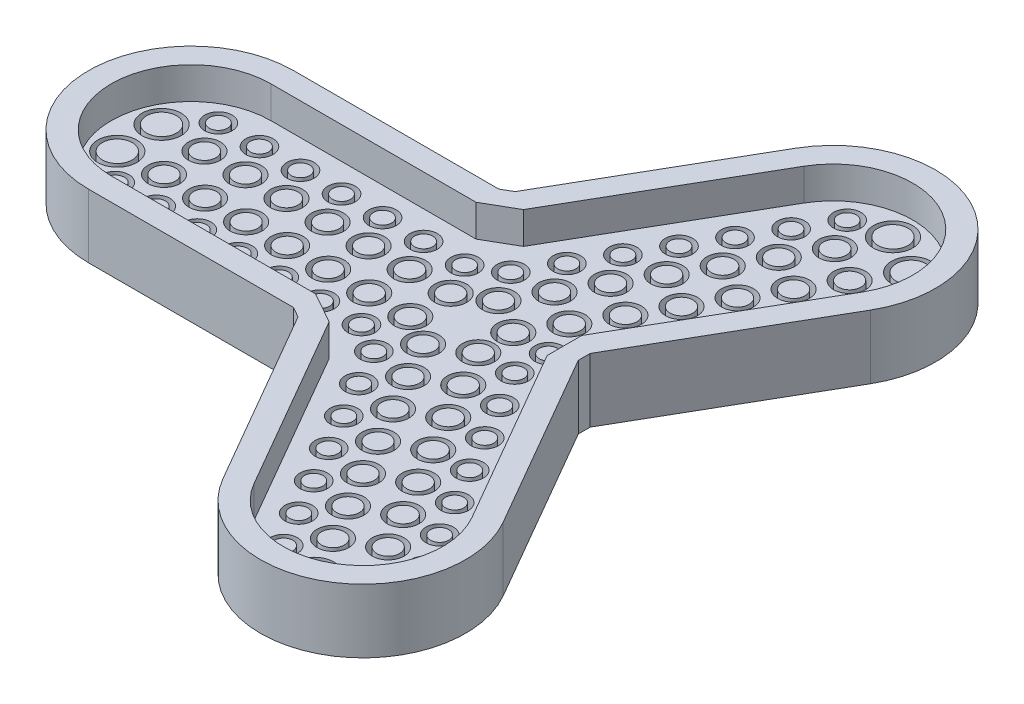
from build123d import *

# Parameters (mm, degrees)
BOSS_EXTRUDE1_DEPTH = 14
BOSS_EXTRUDE2_DEPTH = 7
SKETCH2_R           = 3.5
SKETCH2_R_2         = 2.5
SKETCH2_R_3         = 3
SKETCH2_R_4         = 2
SKETCH2_R_5         = 4.287290874
SKETCH2_R_6         = 3.287290874
CUT_EXTRUDE1_DEPTH  = 4


with BuildPart() as part:
    # Sketch1 → Boss-Extrude1 (new body)
    with BuildSketch(Plane(origin=(0, 0, 0), x_dir=(1, 0, 0), z_dir=(0, 1, 0))):
        with BuildLine():
            Line((-22.5, -22.5), (22.5, -22.5))
            Line((22.5, -22.5), (24.764428415, -23.807368355))
            Line((24.764428415, -23.807368355), (47.264428415, -62.778511525))
            ThreePointArc((47.264428415, -62.778511525), (78, -71.01408311), (86.235571585, -40.278511525))
            Line((86.235571585, -40.278511525), (63.735571585, -1.307368355))
            Line((63.735571585, -1.307368355), (63.735571585, 1.307368355))
            Line((63.735571585, 1.307368355), (86.235571585, 40.278511525))
            ThreePointArc((86.235571585, 40.278511525), (78, 71.01408311), (47.264428415, 62.778511525))
            Line((47.264428415, 62.778511525), (24.764428415, 23.807368355))
            Line((24.764428415, 23.807368355), (22.5, 22.5))
            Line((22.5, 22.5), (-22.5, 22.5))
            ThreePointArc((-22.5, 22.5), (-45, 0), (-22.5, -22.5))
        make_face()
        with BuildLine():
            ThreePointArc((-22.5, -17.5), (-40, 0), (-22.5, 17.5))
            Line((-22.5, 17.5), (22.5, 17.5))
            Line((22.5, 17.5), (29.094555434, 21.307368355))
            Line((29.094555434, 21.307368355), (51.594555434, 60.278511525))
            ThreePointArc((51.594555434, 60.278511525), (75.5, 66.683956091), (81.905444566, 42.778511525))
            Line((81.905444566, 42.778511525), (59.405444566, 3.807368355))
            Line((59.405444566, 3.807368355), (59.405444566, -3.807368355))
            Line((59.405444566, -3.807368355), (81.905444566, -42.778511525))
            ThreePointArc((81.905444566, -42.778511525), (75.5, -66.683956091), (51.594555434, -60.278511525))
            Line((51.594555434, -60.278511525), (29.094555434, -21.307368355))
            Line((29.094555434, -21.307368355), (22.299592432, -17.5))
            Line((22.299592432, -17.5), (-22.5, -17.5))
        make_face(mode=Mode.SUBTRACT)
    extrude(amount=BOSS_EXTRUDE1_DEPTH)

    # Sketch1<2> → Boss-Extrude2 (add)
    with BuildSketch(Plane(origin=(0, 0, 0), x_dir=(1, 0, 0), z_dir=(0, 1, 0))):
        with BuildLine():
            Line((22.299592432, 17.5), (-22.5, 17.5))
            ThreePointArc((-22.5, 17.5), (-40, 0), (-22.5, -17.5))
            Line((-22.5, -17.5), (22.299592432, -17.5))
            Line((22.299592432, -17.5), (29.094555434, -21.307368355))
            Line((29.094555434, -21.307368355), (29.194759218, -21.4809264))
            Line((29.194759218, -21.4809264), (51.594555434, -60.278511525))
            ThreePointArc((51.594555434, -60.278511525), (75.5, -66.683956091), (81.905444566, -42.778511525))
            Line((81.905444566, -42.778511525), (59.50564835, -3.9809264))
            Line((59.50564835, -3.9809264), (59.405444566, -3.807368355))
            Line((59.405444566, -3.807368355), (59.405444566, 3.807368355))
            Line((59.405444566, 3.807368355), (59.50564835, 3.9809264))
            Line((59.50564835, 3.9809264), (81.905444566, 42.778511525))
            ThreePointArc((81.905444566, 42.778511525), (75.5, 66.683956091), (51.594555434, 60.278511525))
            Line((51.594555434, 60.278511525), (29.194759218, 21.4809264))
            Line((29.194759218, 21.4809264), (29.094555434, 21.307368355))
            Line((29.094555434, 21.307368355), (22.5, 17.5))
            Line((22.5, 17.5), (22.299592432, 17.5))
        make_face()
    extrude(amount=BOSS_EXTRUDE2_DEPTH)

    # Sketch2 → Cut-Extrude1 (cut)
    # profile 1 of 90: a face of its own
    with BuildSketch(Plane(origin=(0, 7, 0), x_dir=(1, 0, 0), z_dir=(0, 1, 0))):
        with Locations((30.011797316, -4.431729837)):
            Circle(SKETCH2_R)
        with Locations((30.011797316, -4.431729837)):
            Circle(SKETCH2_R_2, mode=Mode.SUBTRACT)
    # profile 2 of 90: a face of its own
    with BuildSketch(Plane(origin=(0, 7, 0), x_dir=(1, 0, 0), z_dir=(0, 1, 0))):
        with Locations((21.011797316, -4.431729837)):
            Circle(SKETCH2_R)
        with Locations((21.011797316, -4.431729837)):
            Circle(SKETCH2_R_2, mode=Mode.SUBTRACT)
    # profile 3 of 90: a face of its own
    with BuildSketch(Plane(origin=(0, 7, 0), x_dir=(1, 0, 0), z_dir=(0, 1, 0))):
        with Locations((12.011797316, -4.431729837)):
            Circle(SKETCH2_R)
        with Locations((12.011797316, -4.431729837)):
            Circle(SKETCH2_R_2, mode=Mode.SUBTRACT)
    # profile 4 of 90: a face of its own
    with BuildSketch(Plane(origin=(0, 7, 0), x_dir=(1, 0, 0), z_dir=(0, 1, 0))):
        with Locations((3.011797316, -4.431729837)):
            Circle(SKETCH2_R)
        with Locations((3.011797316, -4.431729837)):
            Circle(SKETCH2_R_2, mode=Mode.SUBTRACT)
    # profile 5 of 90: a face of its own
    with BuildSketch(Plane(origin=(0, 7, 0), x_dir=(1, 0, 0), z_dir=(0, 1, 0))):
        with Locations((-5.988202684, -4.431729837)):
            Circle(SKETCH2_R)
        with Locations((-5.988202684, -4.431729837)):
            Circle(SKETCH2_R_2, mode=Mode.SUBTRACT)
    # profile 6 of 90: a face of its own
    with BuildSketch(Plane(origin=(0, 7, 0), x_dir=(1, 0, 0), z_dir=(0, 1, 0))):
        with Locations((-14.988202684, -4.431729837)):
            Circle(SKETCH2_R)
        with Locations((-14.988202684, -4.431729837)):
            Circle(SKETCH2_R_2, mode=Mode.SUBTRACT)
    # profile 7 of 90: a face of its own
    with BuildSketch(Plane(origin=(0, 7, 0), x_dir=(1, 0, 0), z_dir=(0, 1, 0))):
        with Locations((-27.809609086, -11.315014847)):
            Circle(SKETCH2_R_3)
        with Locations((-27.809609086, -11.315014847)):
            Circle(SKETCH2_R_4, mode=Mode.SUBTRACT)
    # profile 8 of 90: a face of its own
    with BuildSketch(Plane(origin=(0, 7, 0), x_dir=(1, 0, 0), z_dir=(0, 1, 0))):
        with Locations((-18.809609086, -11.315014847)):
            Circle(SKETCH2_R_3)
        with Locations((-18.809609086, -11.315014847)):
            Circle(SKETCH2_R_4, mode=Mode.SUBTRACT)
    # profile 9 of 90: a face of its own
    with BuildSketch(Plane(origin=(0, 7, 0), x_dir=(1, 0, 0), z_dir=(0, 1, 0))):
        with Locations((-9.809609086, -11.315014847)):
            Circle(SKETCH2_R_3)
        with Locations((-9.809609086, -11.315014847)):
            Circle(SKETCH2_R_4, mode=Mode.SUBTRACT)
    # profile 10 of 90: a face of its own
    with BuildSketch(Plane(origin=(0, 7, 0), x_dir=(1, 0, 0), z_dir=(0, 1, 0))):
        with Locations((-0.809609086, -11.315014847)):
            Circle(SKETCH2_R_3)
        with Locations((-0.809609086, -11.315014847)):
            Circle(SKETCH2_R_4, mode=Mode.SUBTRACT)
    # profile 11 of 90: a face of its own
    with BuildSketch(Plane(origin=(0, 7, 0), x_dir=(1, 0, 0), z_dir=(0, 1, 0))):
        with Locations((8.190390914, -11.315014847)):
            Circle(SKETCH2_R_3)
        with Locations((8.190390914, -11.315014847)):
            Circle(SKETCH2_R_4, mode=Mode.SUBTRACT)
    # profile 12 of 90: a face of its own
    with BuildSketch(Plane(origin=(0, 7, 0), x_dir=(1, 0, 0), z_dir=(0, 1, 0))):
        with Locations((17.190390914, -11.315014847)):
            Circle(SKETCH2_R_3)
        with Locations((17.190390914, -11.315014847)):
            Circle(SKETCH2_R_4, mode=Mode.SUBTRACT)
    # profile 13 of 90: a face of its own
    with BuildSketch(Plane(origin=(0, 7, 0), x_dir=(1, 0, 0), z_dir=(0, 1, 0))):
        with Locations((26.190390914, -11.315014847)):
            Circle(SKETCH2_R_3)
        with Locations((26.190390914, -11.315014847)):
            Circle(SKETCH2_R_4, mode=Mode.SUBTRACT)
    # profile 14 of 90: a face of its own
    with BuildSketch(Plane(origin=(0, 7, 0), x_dir=(1, 0, 0), z_dir=(0, 1, 0))):
        with Locations((-23.988202684, -4.431729837)):
            Circle(SKETCH2_R)
        with Locations((-23.988202684, -4.431729837)):
            Circle(SKETCH2_R_2, mode=Mode.SUBTRACT)
    # profile 15 of 90: a face of its own
    with BuildSketch(Plane(origin=(0, 7, 0), x_dir=(1, 0, 0), z_dir=(0, 1, 0))):
        with Locations((-23.988202684, 4.431729837)):
            Circle(SKETCH2_R)
        with Locations((-23.988202684, 4.431729837)):
            Circle(SKETCH2_R_2, mode=Mode.SUBTRACT)
    # profile 16 of 90: a face of its own
    with BuildSketch(Plane(origin=(0, 7, 0), x_dir=(1, 0, 0), z_dir=(0, 1, 0))):
        with Locations((-14.988202684, 4.431729837)):
            Circle(SKETCH2_R)
        with Locations((-14.988202684, 4.431729837)):
            Circle(SKETCH2_R_2, mode=Mode.SUBTRACT)
    # profile 17 of 90: a face of its own
    with BuildSketch(Plane(origin=(0, 7, 0), x_dir=(1, 0, 0), z_dir=(0, 1, 0))):
        with Locations((-5.988202684, 4.431729837)):
            Circle(SKETCH2_R)
        with Locations((-5.988202684, 4.431729837)):
            Circle(SKETCH2_R_2, mode=Mode.SUBTRACT)
    # profile 18 of 90: a face of its own
    with BuildSketch(Plane(origin=(0, 7, 0), x_dir=(1, 0, 0), z_dir=(0, 1, 0))):
        with Locations((3.011797316, 4.431729837)):
            Circle(SKETCH2_R)
        with Locations((3.011797316, 4.431729837)):
            Circle(SKETCH2_R_2, mode=Mode.SUBTRACT)
    # profile 19 of 90: a face of its own
    with BuildSketch(Plane(origin=(0, 7, 0), x_dir=(1, 0, 0), z_dir=(0, 1, 0))):
        with Locations((12.011797316, 4.431729837)):
            Circle(SKETCH2_R)
        with Locations((12.011797316, 4.431729837)):
            Circle(SKETCH2_R_2, mode=Mode.SUBTRACT)
    # profile 20 of 90: a face of its own
    with BuildSketch(Plane(origin=(0, 7, 0), x_dir=(1, 0, 0), z_dir=(0, 1, 0))):
        with Locations((21.011797316, 4.431729837)):
            Circle(SKETCH2_R)
        with Locations((21.011797316, 4.431729837)):
            Circle(SKETCH2_R_2, mode=Mode.SUBTRACT)
    # profile 21 of 90: a face of its own
    with BuildSketch(Plane(origin=(0, 7, 0), x_dir=(1, 0, 0), z_dir=(0, 1, 0))):
        with Locations((30.011797316, 4.431729837)):
            Circle(SKETCH2_R)
        with Locations((30.011797316, 4.431729837)):
            Circle(SKETCH2_R_2, mode=Mode.SUBTRACT)
    # profile 22 of 90: a face of its own
    with BuildSketch(Plane(origin=(0, 7, 0), x_dir=(1, 0, 0), z_dir=(0, 1, 0))):
        with Locations((26.190390914, 11.315014847)):
            Circle(SKETCH2_R_3)
        with Locations((26.190390914, 11.315014847)):
            Circle(SKETCH2_R_4, mode=Mode.SUBTRACT)
    # profile 23 of 90: a face of its own
    with BuildSketch(Plane(origin=(0, 7, 0), x_dir=(1, 0, 0), z_dir=(0, 1, 0))):
        with Locations((17.190390914, 11.315014847)):
            Circle(SKETCH2_R_3)
        with Locations((17.190390914, 11.315014847)):
            Circle(SKETCH2_R_4, mode=Mode.SUBTRACT)
    # profile 24 of 90: a face of its own
    with BuildSketch(Plane(origin=(0, 7, 0), x_dir=(1, 0, 0), z_dir=(0, 1, 0))):
        with Locations((8.190390914, 11.315014847)):
            Circle(SKETCH2_R_3)
        with Locations((8.190390914, 11.315014847)):
            Circle(SKETCH2_R_4, mode=Mode.SUBTRACT)
    # profile 25 of 90: a face of its own
    with BuildSketch(Plane(origin=(0, 7, 0), x_dir=(1, 0, 0), z_dir=(0, 1, 0))):
        with Locations((-0.809609086, 11.315014847)):
            Circle(SKETCH2_R_3)
        with Locations((-0.809609086, 11.315014847)):
            Circle(SKETCH2_R_4, mode=Mode.SUBTRACT)
    # profile 26 of 90: a face of its own
    with BuildSketch(Plane(origin=(0, 7, 0), x_dir=(1, 0, 0), z_dir=(0, 1, 0))):
        with Locations((-9.809609086, 11.315014847)):
            Circle(SKETCH2_R_3)
        with Locations((-9.809609086, 11.315014847)):
            Circle(SKETCH2_R_4, mode=Mode.SUBTRACT)
    # profile 27 of 90: a face of its own
    with BuildSketch(Plane(origin=(0, 7, 0), x_dir=(1, 0, 0), z_dir=(0, 1, 0))):
        with Locations((-18.809609086, 11.315014847)):
            Circle(SKETCH2_R_3)
        with Locations((-18.809609086, 11.315014847)):
            Circle(SKETCH2_R_4, mode=Mode.SUBTRACT)
    # profile 28 of 90: a face of its own
    with BuildSketch(Plane(origin=(0, 7, 0), x_dir=(1, 0, 0), z_dir=(0, 1, 0))):
        with Locations((-27.809609086, 11.315014847)):
            Circle(SKETCH2_R_3)
        with Locations((-27.809609086, 11.315014847)):
            Circle(SKETCH2_R_4, mode=Mode.SUBTRACT)
    # profile 29 of 90: a face of its own
    with BuildSketch(Plane(origin=(0, 7, 0), x_dir=(1, 0, 0), z_dir=(0, 1, 0))):
        with Locations((-33.519550932, -5.159053716)):
            Circle(SKETCH2_R_5)
        with Locations((-33.519550932, -5.159053716)):
            Circle(SKETCH2_R_6, mode=Mode.SUBTRACT)
    # profile 30 of 90: a face of its own
    with BuildSketch(Plane(origin=(0, 7, 0), x_dir=(1, 0, 0), z_dir=(0, 1, 0))):
        with Locations((-33.764843827, 4.799837797)):
            Circle(SKETCH2_R_5)
        with Locations((-33.764843827, 4.799837797)):
            Circle(SKETCH2_R_6, mode=Mode.SUBTRACT)
    # profile 31 of 90: a face of its own
    with BuildSketch(Plane(origin=(0, 7, 0), x_dir=(1, 0, 0), z_dir=(0, 1, 0))):
        with Locations((36.656110721, 8.26782597)):
            Circle(SKETCH2_R)
        with Locations((36.656110721, 8.26782597)):
            Circle(SKETCH2_R_2, mode=Mode.SUBTRACT)
    # profile 32 of 90: a face of its own
    with BuildSketch(Plane(origin=(0, 7, 0), x_dir=(1, 0, 0), z_dir=(0, 1, 0))):
        with Locations((41.156110721, 16.062054604)):
            Circle(SKETCH2_R)
        with Locations((41.156110721, 16.062054604)):
            Circle(SKETCH2_R_2, mode=Mode.SUBTRACT)
    # profile 33 of 90: a face of its own
    with BuildSketch(Plane(origin=(0, 7, 0), x_dir=(1, 0, 0), z_dir=(0, 1, 0))):
        with Locations((45.656110721, 23.856283238)):
            Circle(SKETCH2_R)
        with Locations((45.656110721, 23.856283238)):
            Circle(SKETCH2_R_2, mode=Mode.SUBTRACT)
    # profile 34 of 90: a face of its own
    with BuildSketch(Plane(origin=(0, 7, 0), x_dir=(1, 0, 0), z_dir=(0, 1, 0))):
        with Locations((50.156110721, 31.650511872)):
            Circle(SKETCH2_R)
        with Locations((50.156110721, 31.650511872)):
            Circle(SKETCH2_R_2, mode=Mode.SUBTRACT)
    # profile 35 of 90: a face of its own
    with BuildSketch(Plane(origin=(0, 7, 0), x_dir=(1, 0, 0), z_dir=(0, 1, 0))):
        with Locations((54.656110721, 39.444740506)):
            Circle(SKETCH2_R)
        with Locations((54.656110721, 39.444740506)):
            Circle(SKETCH2_R_2, mode=Mode.SUBTRACT)
    # profile 36 of 90: a face of its own
    with BuildSketch(Plane(origin=(0, 7, 0), x_dir=(1, 0, 0), z_dir=(0, 1, 0))):
        with Locations((59.156110721, 47.23896914)):
            Circle(SKETCH2_R)
        with Locations((59.156110721, 47.23896914)):
            Circle(SKETCH2_R_2, mode=Mode.SUBTRACT)
    # profile 37 of 90: a face of its own
    with BuildSketch(Plane(origin=(0, 7, 0), x_dir=(1, 0, 0), z_dir=(0, 1, 0))):
        with Locations((59.605714242, 61.784275301)):
            Circle(SKETCH2_R_3)
        with Locations((59.605714242, 61.784275301)):
            Circle(SKETCH2_R_4, mode=Mode.SUBTRACT)
    # profile 38 of 90: a face of its own
    with BuildSketch(Plane(origin=(0, 7, 0), x_dir=(1, 0, 0), z_dir=(0, 1, 0))):
        with Locations((55.105714242, 53.990046667)):
            Circle(SKETCH2_R_3)
        with Locations((55.105714242, 53.990046667)):
            Circle(SKETCH2_R_4, mode=Mode.SUBTRACT)
    # profile 39 of 90: a face of its own
    with BuildSketch(Plane(origin=(0, 7, 0), x_dir=(1, 0, 0), z_dir=(0, 1, 0))):
        with Locations((50.605714242, 46.195818033)):
            Circle(SKETCH2_R_3)
        with Locations((50.605714242, 46.195818033)):
            Circle(SKETCH2_R_4, mode=Mode.SUBTRACT)
    # profile 40 of 90: a face of its own
    with BuildSketch(Plane(origin=(0, 7, 0), x_dir=(1, 0, 0), z_dir=(0, 1, 0))):
        with Locations((46.105714242, 38.401589399)):
            Circle(SKETCH2_R_3)
        with Locations((46.105714242, 38.401589399)):
            Circle(SKETCH2_R_4, mode=Mode.SUBTRACT)
    # profile 41 of 90: a face of its own
    with BuildSketch(Plane(origin=(0, 7, 0), x_dir=(1, 0, 0), z_dir=(0, 1, 0))):
        with Locations((41.605714242, 30.607360765)):
            Circle(SKETCH2_R_3)
        with Locations((41.605714242, 30.607360765)):
            Circle(SKETCH2_R_4, mode=Mode.SUBTRACT)
    # profile 42 of 90: a face of its own
    with BuildSketch(Plane(origin=(0, 7, 0), x_dir=(1, 0, 0), z_dir=(0, 1, 0))):
        with Locations((37.105714242, 22.813132131)):
            Circle(SKETCH2_R_3)
        with Locations((37.105714242, 22.813132131)):
            Circle(SKETCH2_R_4, mode=Mode.SUBTRACT)
    # profile 43 of 90: a face of its own
    with BuildSketch(Plane(origin=(0, 7, 0), x_dir=(1, 0, 0), z_dir=(0, 1, 0))):
        with Locations((32.605714242, 15.018903497)):
            Circle(SKETCH2_R_3)
        with Locations((32.605714242, 15.018903497)):
            Circle(SKETCH2_R_4, mode=Mode.SUBTRACT)
    # profile 44 of 90: a face of its own
    with BuildSketch(Plane(origin=(0, 7, 0), x_dir=(1, 0, 0), z_dir=(0, 1, 0))):
        with Locations((63.656110721, 55.033197774)):
            Circle(SKETCH2_R)
        with Locations((63.656110721, 55.033197774)):
            Circle(SKETCH2_R_2, mode=Mode.SUBTRACT)
    # profile 45 of 90: a face of its own
    with BuildSketch(Plane(origin=(0, 7, 0), x_dir=(1, 0, 0), z_dir=(0, 1, 0))):
        with Locations((71.332091963, 50.601467937)):
            Circle(SKETCH2_R)
        with Locations((71.332091963, 50.601467937)):
            Circle(SKETCH2_R_2, mode=Mode.SUBTRACT)
    # profile 46 of 90: a face of its own
    with BuildSketch(Plane(origin=(0, 7, 0), x_dir=(1, 0, 0), z_dir=(0, 1, 0))):
        with Locations((66.832091963, 42.807239303)):
            Circle(SKETCH2_R)
        with Locations((66.832091963, 42.807239303)):
            Circle(SKETCH2_R_2, mode=Mode.SUBTRACT)
    # profile 47 of 90: a face of its own
    with BuildSketch(Plane(origin=(0, 7, 0), x_dir=(1, 0, 0), z_dir=(0, 1, 0))):
        with Locations((62.332091963, 35.013010669)):
            Circle(SKETCH2_R)
        with Locations((62.332091963, 35.013010669)):
            Circle(SKETCH2_R_2, mode=Mode.SUBTRACT)
    # profile 48 of 90: a face of its own
    with BuildSketch(Plane(origin=(0, 7, 0), x_dir=(1, 0, 0), z_dir=(0, 1, 0))):
        with Locations((57.832091963, 27.218782035)):
            Circle(SKETCH2_R)
        with Locations((57.832091963, 27.218782035)):
            Circle(SKETCH2_R_2, mode=Mode.SUBTRACT)
    # profile 49 of 90: a face of its own
    with BuildSketch(Plane(origin=(0, 7, 0), x_dir=(1, 0, 0), z_dir=(0, 1, 0))):
        with Locations((53.332091963, 19.424553401)):
            Circle(SKETCH2_R)
        with Locations((53.332091963, 19.424553401)):
            Circle(SKETCH2_R_2, mode=Mode.SUBTRACT)
    # profile 50 of 90: a face of its own
    with BuildSketch(Plane(origin=(0, 7, 0), x_dir=(1, 0, 0), z_dir=(0, 1, 0))):
        with Locations((48.832091963, 11.630324767)):
            Circle(SKETCH2_R)
        with Locations((48.832091963, 11.630324767)):
            Circle(SKETCH2_R_2, mode=Mode.SUBTRACT)
    # profile 51 of 90: a face of its own
    with BuildSketch(Plane(origin=(0, 7, 0), x_dir=(1, 0, 0), z_dir=(0, 1, 0))):
        with Locations((44.332091963, 3.836096133)):
            Circle(SKETCH2_R)
        with Locations((44.332091963, 3.836096133)):
            Circle(SKETCH2_R_2, mode=Mode.SUBTRACT)
    # profile 52 of 90: a face of its own
    with BuildSketch(Plane(origin=(0, 7, 0), x_dir=(1, 0, 0), z_dir=(0, 1, 0))):
        with Locations((52.203894844, 3.70388865)):
            Circle(SKETCH2_R_3)
        with Locations((52.203894844, 3.70388865)):
            Circle(SKETCH2_R_4, mode=Mode.SUBTRACT)
    # profile 53 of 90: a face of its own
    with BuildSketch(Plane(origin=(0, 7, 0), x_dir=(1, 0, 0), z_dir=(0, 1, 0))):
        with Locations((56.703894844, 11.498117284)):
            Circle(SKETCH2_R_3)
        with Locations((56.703894844, 11.498117284)):
            Circle(SKETCH2_R_4, mode=Mode.SUBTRACT)
    # profile 54 of 90: a face of its own
    with BuildSketch(Plane(origin=(0, 7, 0), x_dir=(1, 0, 0), z_dir=(0, 1, 0))):
        with Locations((61.203894844, 19.292345918)):
            Circle(SKETCH2_R_3)
        with Locations((61.203894844, 19.292345918)):
            Circle(SKETCH2_R_4, mode=Mode.SUBTRACT)
    # profile 55 of 90: a face of its own
    with BuildSketch(Plane(origin=(0, 7, 0), x_dir=(1, 0, 0), z_dir=(0, 1, 0))):
        with Locations((65.703894844, 27.086574552)):
            Circle(SKETCH2_R_3)
        with Locations((65.703894844, 27.086574552)):
            Circle(SKETCH2_R_4, mode=Mode.SUBTRACT)
    # profile 56 of 90: a face of its own
    with BuildSketch(Plane(origin=(0, 7, 0), x_dir=(1, 0, 0), z_dir=(0, 1, 0))):
        with Locations((70.203894844, 34.880803186)):
            Circle(SKETCH2_R_3)
        with Locations((70.203894844, 34.880803186)):
            Circle(SKETCH2_R_4, mode=Mode.SUBTRACT)
    # profile 57 of 90: a face of its own
    with BuildSketch(Plane(origin=(0, 7, 0), x_dir=(1, 0, 0), z_dir=(0, 1, 0))):
        with Locations((74.703894844, 42.67503182)):
            Circle(SKETCH2_R_3)
        with Locations((74.703894844, 42.67503182)):
            Circle(SKETCH2_R_4, mode=Mode.SUBTRACT)
    # profile 58 of 90: a face of its own
    with BuildSketch(Plane(origin=(0, 7, 0), x_dir=(1, 0, 0), z_dir=(0, 1, 0))):
        with Locations((79.203894844, 50.469260455)):
            Circle(SKETCH2_R_3)
        with Locations((79.203894844, 50.469260455)):
            Circle(SKETCH2_R_4, mode=Mode.SUBTRACT)
    # profile 59 of 90: a face of its own
    with BuildSketch(Plane(origin=(0, 7, 0), x_dir=(1, 0, 0), z_dir=(0, 1, 0))):
        with Locations((67.791903889, 63.651249429)):
            Circle(SKETCH2_R_5)
        with Locations((67.791903889, 63.651249429)):
            Circle(SKETCH2_R_6, mode=Mode.SUBTRACT)
    # profile 60 of 90: a face of its own
    with BuildSketch(Plane(origin=(0, 7, 0), x_dir=(1, 0, 0), z_dir=(0, 1, 0))):
        with Locations((76.53920338, 58.88423355)):
            Circle(SKETCH2_R_5)
        with Locations((76.53920338, 58.88423355)):
            Circle(SKETCH2_R_6, mode=Mode.SUBTRACT)
    # profile 61 of 90: a face of its own
    with BuildSketch(Plane(origin=(0, 7, 0), x_dir=(1, 0, 0), z_dir=(0, 1, 0))):
        with Locations((44.332091963, -3.836096133)):
            Circle(SKETCH2_R)
        with Locations((44.332091963, -3.836096133)):
            Circle(SKETCH2_R_2, mode=Mode.SUBTRACT)
    # profile 62 of 90: a face of its own
    with BuildSketch(Plane(origin=(0, 7, 0), x_dir=(1, 0, 0), z_dir=(0, 1, 0))):
        with Locations((48.832091963, -11.630324767)):
            Circle(SKETCH2_R)
        with Locations((48.832091963, -11.630324767)):
            Circle(SKETCH2_R_2, mode=Mode.SUBTRACT)
    # profile 63 of 90: a face of its own
    with BuildSketch(Plane(origin=(0, 7, 0), x_dir=(1, 0, 0), z_dir=(0, 1, 0))):
        with Locations((53.332091963, -19.424553401)):
            Circle(SKETCH2_R)
        with Locations((53.332091963, -19.424553401)):
            Circle(SKETCH2_R_2, mode=Mode.SUBTRACT)
    # profile 64 of 90: a face of its own
    with BuildSketch(Plane(origin=(0, 7, 0), x_dir=(1, 0, 0), z_dir=(0, 1, 0))):
        with Locations((57.832091963, -27.218782035)):
            Circle(SKETCH2_R)
        with Locations((57.832091963, -27.218782035)):
            Circle(SKETCH2_R_2, mode=Mode.SUBTRACT)
    # profile 65 of 90: a face of its own
    with BuildSketch(Plane(origin=(0, 7, 0), x_dir=(1, 0, 0), z_dir=(0, 1, 0))):
        with Locations((62.332091963, -35.013010669)):
            Circle(SKETCH2_R)
        with Locations((62.332091963, -35.013010669)):
            Circle(SKETCH2_R_2, mode=Mode.SUBTRACT)
    # profile 66 of 90: a face of its own
    with BuildSketch(Plane(origin=(0, 7, 0), x_dir=(1, 0, 0), z_dir=(0, 1, 0))):
        with Locations((66.832091963, -42.807239303)):
            Circle(SKETCH2_R)
        with Locations((66.832091963, -42.807239303)):
            Circle(SKETCH2_R_2, mode=Mode.SUBTRACT)
    # profile 67 of 90: a face of its own
    with BuildSketch(Plane(origin=(0, 7, 0), x_dir=(1, 0, 0), z_dir=(0, 1, 0))):
        with Locations((79.203894844, -50.469260455)):
            Circle(SKETCH2_R_3)
        with Locations((79.203894844, -50.469260455)):
            Circle(SKETCH2_R_4, mode=Mode.SUBTRACT)
    # profile 68 of 90: a face of its own
    with BuildSketch(Plane(origin=(0, 7, 0), x_dir=(1, 0, 0), z_dir=(0, 1, 0))):
        with Locations((74.703894844, -42.67503182)):
            Circle(SKETCH2_R_3)
        with Locations((74.703894844, -42.67503182)):
            Circle(SKETCH2_R_4, mode=Mode.SUBTRACT)
    # profile 69 of 90: a face of its own
    with BuildSketch(Plane(origin=(0, 7, 0), x_dir=(1, 0, 0), z_dir=(0, 1, 0))):
        with Locations((70.203894844, -34.880803186)):
            Circle(SKETCH2_R_3)
        with Locations((70.203894844, -34.880803186)):
            Circle(SKETCH2_R_4, mode=Mode.SUBTRACT)
    # profile 70 of 90: a face of its own
    with BuildSketch(Plane(origin=(0, 7, 0), x_dir=(1, 0, 0), z_dir=(0, 1, 0))):
        with Locations((65.703894844, -27.086574552)):
            Circle(SKETCH2_R_3)
        with Locations((65.703894844, -27.086574552)):
            Circle(SKETCH2_R_4, mode=Mode.SUBTRACT)
    # profile 71 of 90: a face of its own
    with BuildSketch(Plane(origin=(0, 7, 0), x_dir=(1, 0, 0), z_dir=(0, 1, 0))):
        with Locations((61.203894844, -19.292345918)):
            Circle(SKETCH2_R_3)
        with Locations((61.203894844, -19.292345918)):
            Circle(SKETCH2_R_4, mode=Mode.SUBTRACT)
    # profile 72 of 90: a face of its own
    with BuildSketch(Plane(origin=(0, 7, 0), x_dir=(1, 0, 0), z_dir=(0, 1, 0))):
        with Locations((56.703894844, -11.498117284)):
            Circle(SKETCH2_R_3)
        with Locations((56.703894844, -11.498117284)):
            Circle(SKETCH2_R_4, mode=Mode.SUBTRACT)
    # profile 73 of 90: a face of its own
    with BuildSketch(Plane(origin=(0, 7, 0), x_dir=(1, 0, 0), z_dir=(0, 1, 0))):
        with Locations((52.203894844, -3.70388865)):
            Circle(SKETCH2_R_3)
        with Locations((52.203894844, -3.70388865)):
            Circle(SKETCH2_R_4, mode=Mode.SUBTRACT)
    # profile 74 of 90: a face of its own
    with BuildSketch(Plane(origin=(0, 7, 0), x_dir=(1, 0, 0), z_dir=(0, 1, 0))):
        with Locations((71.332091963, -50.601467937)):
            Circle(SKETCH2_R)
        with Locations((71.332091963, -50.601467937)):
            Circle(SKETCH2_R_2, mode=Mode.SUBTRACT)
    # profile 75 of 90: a face of its own
    with BuildSketch(Plane(origin=(0, 7, 0), x_dir=(1, 0, 0), z_dir=(0, 1, 0))):
        with Locations((63.656110721, -55.033197774)):
            Circle(SKETCH2_R)
        with Locations((63.656110721, -55.033197774)):
            Circle(SKETCH2_R_2, mode=Mode.SUBTRACT)
    # profile 76 of 90: a face of its own
    with BuildSketch(Plane(origin=(0, 7, 0), x_dir=(1, 0, 0), z_dir=(0, 1, 0))):
        with Locations((59.156110721, -47.23896914)):
            Circle(SKETCH2_R)
        with Locations((59.156110721, -47.23896914)):
            Circle(SKETCH2_R_2, mode=Mode.SUBTRACT)
    # profile 77 of 90: a face of its own
    with BuildSketch(Plane(origin=(0, 7, 0), x_dir=(1, 0, 0), z_dir=(0, 1, 0))):
        with Locations((54.656110721, -39.444740506)):
            Circle(SKETCH2_R)
        with Locations((54.656110721, -39.444740506)):
            Circle(SKETCH2_R_2, mode=Mode.SUBTRACT)
    # profile 78 of 90: a face of its own
    with BuildSketch(Plane(origin=(0, 7, 0), x_dir=(1, 0, 0), z_dir=(0, 1, 0))):
        with Locations((50.156110721, -31.650511872)):
            Circle(SKETCH2_R)
        with Locations((50.156110721, -31.650511872)):
            Circle(SKETCH2_R_2, mode=Mode.SUBTRACT)
    # profile 79 of 90: a face of its own
    with BuildSketch(Plane(origin=(0, 7, 0), x_dir=(1, 0, 0), z_dir=(0, 1, 0))):
        with Locations((45.656110721, -23.856283238)):
            Circle(SKETCH2_R)
        with Locations((45.656110721, -23.856283238)):
            Circle(SKETCH2_R_2, mode=Mode.SUBTRACT)
    # profile 80 of 90: a face of its own
    with BuildSketch(Plane(origin=(0, 7, 0), x_dir=(1, 0, 0), z_dir=(0, 1, 0))):
        with Locations((41.156110721, -16.062054604)):
            Circle(SKETCH2_R)
        with Locations((41.156110721, -16.062054604)):
            Circle(SKETCH2_R_2, mode=Mode.SUBTRACT)
    # profile 81 of 90: a face of its own
    with BuildSketch(Plane(origin=(0, 7, 0), x_dir=(1, 0, 0), z_dir=(0, 1, 0))):
        with Locations((36.656110721, -8.26782597)):
            Circle(SKETCH2_R)
        with Locations((36.656110721, -8.26782597)):
            Circle(SKETCH2_R_2, mode=Mode.SUBTRACT)
    # profile 82 of 90: a face of its own
    with BuildSketch(Plane(origin=(0, 7, 0), x_dir=(1, 0, 0), z_dir=(0, 1, 0))):
        with Locations((32.605714242, -15.018903497)):
            Circle(SKETCH2_R_3)
        with Locations((32.605714242, -15.018903497)):
            Circle(SKETCH2_R_4, mode=Mode.SUBTRACT)
    # profile 83 of 90: a face of its own
    with BuildSketch(Plane(origin=(0, 7, 0), x_dir=(1, 0, 0), z_dir=(0, 1, 0))):
        with Locations((37.105714242, -22.813132131)):
            Circle(SKETCH2_R_3)
        with Locations((37.105714242, -22.813132131)):
            Circle(SKETCH2_R_4, mode=Mode.SUBTRACT)
    # profile 84 of 90: a face of its own
    with BuildSketch(Plane(origin=(0, 7, 0), x_dir=(1, 0, 0), z_dir=(0, 1, 0))):
        with Locations((41.605714242, -30.607360765)):
            Circle(SKETCH2_R_3)
        with Locations((41.605714242, -30.607360765)):
            Circle(SKETCH2_R_4, mode=Mode.SUBTRACT)
    # profile 85 of 90: a face of its own
    with BuildSketch(Plane(origin=(0, 7, 0), x_dir=(1, 0, 0), z_dir=(0, 1, 0))):
        with Locations((46.105714242, -38.401589399)):
            Circle(SKETCH2_R_3)
        with Locations((46.105714242, -38.401589399)):
            Circle(SKETCH2_R_4, mode=Mode.SUBTRACT)
    # profile 86 of 90: a face of its own
    with BuildSketch(Plane(origin=(0, 7, 0), x_dir=(1, 0, 0), z_dir=(0, 1, 0))):
        with Locations((50.605714242, -46.195818033)):
            Circle(SKETCH2_R_3)
        with Locations((50.605714242, -46.195818033)):
            Circle(SKETCH2_R_4, mode=Mode.SUBTRACT)
    # profile 87 of 90: a face of its own
    with BuildSketch(Plane(origin=(0, 7, 0), x_dir=(1, 0, 0), z_dir=(0, 1, 0))):
        with Locations((55.105714242, -53.990046667)):
            Circle(SKETCH2_R_3)
        with Locations((55.105714242, -53.990046667)):
            Circle(SKETCH2_R_4, mode=Mode.SUBTRACT)
    # profile 88 of 90: a face of its own
    with BuildSketch(Plane(origin=(0, 7, 0), x_dir=(1, 0, 0), z_dir=(0, 1, 0))):
        with Locations((59.605714242, -61.784275301)):
            Circle(SKETCH2_R_3)
        with Locations((59.605714242, -61.784275301)):
            Circle(SKETCH2_R_4, mode=Mode.SUBTRACT)
    # profile 89 of 90: a face of its own
    with BuildSketch(Plane(origin=(0, 7, 0), x_dir=(1, 0, 0), z_dir=(0, 1, 0))):
        with Locations((76.727647044, -58.492195713)):
            Circle(SKETCH2_R_5)
        with Locations((76.727647044, -58.492195713)):
            Circle(SKETCH2_R_6, mode=Mode.SUBTRACT)
    # profile 90 of 90: a face of its own
    with BuildSketch(Plane(origin=(0, 7, 0), x_dir=(1, 0, 0), z_dir=(0, 1, 0))):
        with Locations((68.225640447, -63.684071347)):
            Circle(SKETCH2_R_5)
        with Locations((68.225640447, -63.684071347)):
            Circle(SKETCH2_R_6, mode=Mode.SUBTRACT)
    extrude(amount=-CUT_EXTRUDE1_DEPTH, mode=Mode.SUBTRACT)


solid = part.part
